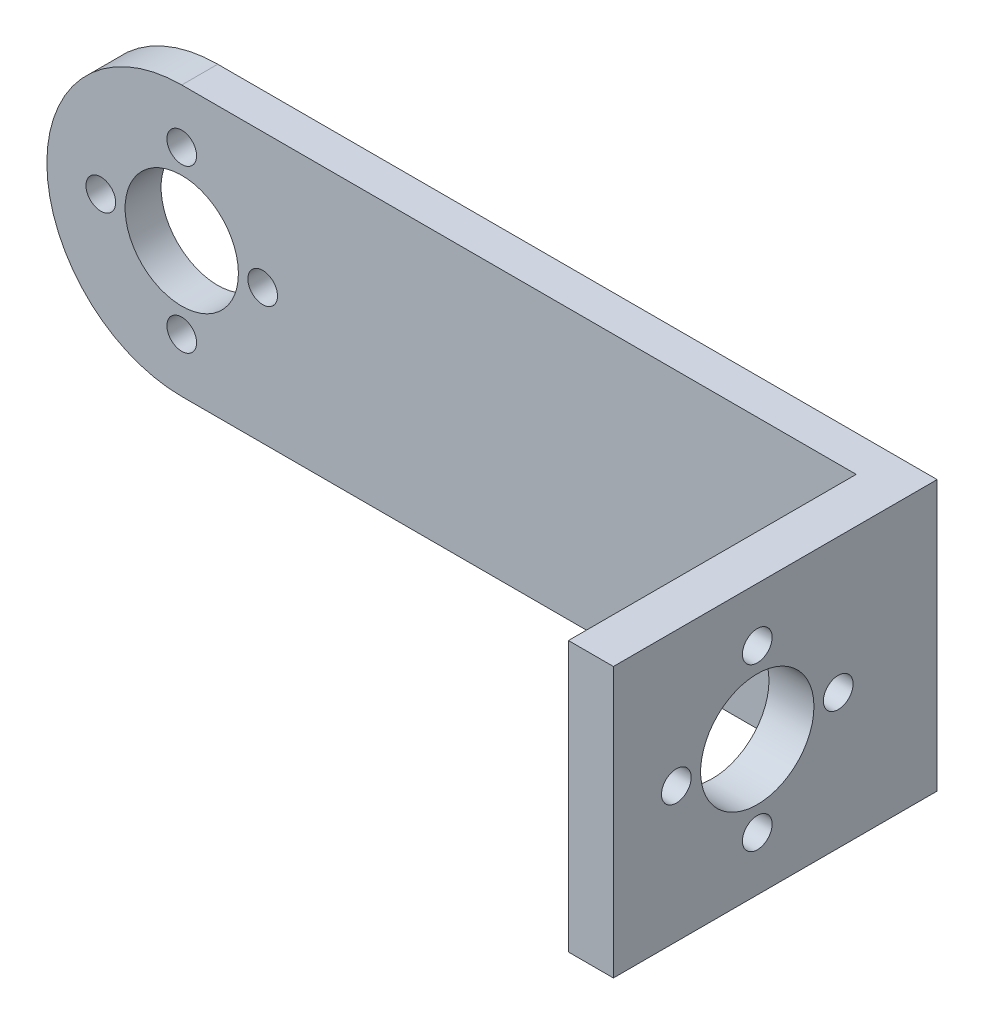
from build123d import *

# Parameters (mm, degrees)
EXTRUDE_1_DEPTH     = 4
SKETCH_2_W          = 5
SKETCH_2_H          = 30
EXTRUDE_2_DEPTH     = 36
SKETCH_4_R          = 6.3
SKETCH_4_R_2        = 1.65
CUT_EXTRUDE_1_DEPTH = 34


with BuildPart() as part:
    # 草图1 → 凸台-拉伸1 (new body)
    with BuildSketch(Plane.XY):
        with BuildLine():
            Line((0, 10.65), (0, 15))
            ThreePointArc((0, 15), (-15, 0), (0, -15))
            Line((0, -15), (0, -10.65))
            ThreePointArc((0, -10.65), (-1.219028814, -10.111966164), (-1.643053084, -8.84875))
            ThreePointArc((-1.643053084, -8.84875), (-6.363961031, -6.363961031), (-8.84875, -1.643053084))
            ThreePointArc((-8.84875, -1.643053084), (-10.65, 0), (-8.84875, 1.643053084))
            ThreePointArc((-8.84875, 1.643053084), (-6.363961031, 6.363961031), (-1.643053084, 8.84875))
            ThreePointArc((-1.643053084, 8.84875), (-1.219028814, 10.111966164), (0, 10.65))
        make_face()
        with BuildLine():
            ThreePointArc((0, 7.35), (-1.111966164, 7.780971186), (-1.643053084, 8.84875))
            ThreePointArc((-1.643053084, 8.84875), (-6.363961031, 6.363961031), (-8.84875, 1.643053084))
            ThreePointArc((-8.84875, 1.643053084), (-7.780971186, 1.111966164), (-7.35, 0))
            ThreePointArc((-7.35, 0), (-7.780971186, -1.111966164), (-8.84875, -1.643053084))
            ThreePointArc((-8.84875, -1.643053084), (-6.363961031, -6.363961031), (-1.643053084, -8.84875))
            ThreePointArc((-1.643053084, -8.84875), (-1.111966164, -7.780971186), (0, -7.35))
            Line((0, -7.35), (0, -6.3))
            ThreePointArc((0, -6.3), (-6.3, 0), (0, 6.3))
            Line((0, 6.3), (0, 7.35))
        make_face()
        with BuildLine():
            ThreePointArc((1.643053084, 8.84875), (1.111966164, 7.780971186), (0, 7.35))
            Line((0, 7.35), (0, 6.3))
            ThreePointArc((0, 6.3), (4.454772721, 4.454772721), (6.3, 0))
            ThreePointArc((6.3, 0), (4.454772721, -4.454772721), (0, -6.3))
            Line((0, -6.3), (0, -7.35))
            ThreePointArc((0, -7.35), (1.111966164, -7.780971186), (1.643053084, -8.84875))
            ThreePointArc((1.643053084, -8.84875), (6.363961031, -6.363961031), (8.84875, -1.643053084))
            ThreePointArc((8.84875, -1.643053084), (7.35, 0), (8.84875, 1.643053084))
            ThreePointArc((8.84875, 1.643053084), (6.363961031, 6.363961031), (1.643053084, 8.84875))
        make_face()
        with BuildLine():
            ThreePointArc((15, 0), (10.606601718, 10.606601718), (0, 15))
            Line((0, 15), (0, 10.65))
            ThreePointArc((0, 10.65), (1.166726189, 10.166726189), (1.65, 9))
            ThreePointArc((1.65, 9), (1.648262356, 8.924295274), (1.643053084, 8.84875))
            ThreePointArc((1.643053084, 8.84875), (6.363961031, 6.363961031), (8.84875, 1.643053084))
            ThreePointArc((8.84875, 1.643053084), (10.111966164, 1.219028814), (10.65, 0))
            ThreePointArc((10.65, 0), (10.111966164, -1.219028814), (8.84875, -1.643053084))
            ThreePointArc((8.84875, -1.643053084), (6.363961031, -6.363961031), (1.643053084, -8.84875))
            ThreePointArc((1.643053084, -8.84875), (1.648262356, -8.924295274), (1.65, -9))
            ThreePointArc((1.65, -9), (1.166726189, -10.166726189), (0, -10.65))
            Line((0, -10.65), (0, -15))
            ThreePointArc((0, -15), (10.606601718, -10.606601718), (15, 0))
        make_face()
        with BuildLine():
            Line((80, 15), (0, 15))
            ThreePointArc((0, 15), (10.606601718, 10.606601718), (15, 0))
            ThreePointArc((15, 0), (10.606601718, -10.606601718), (0, -15))
            Line((0, -15), (80, -15))
            Line((80, -15), (80, 15))
        make_face()
    extrude(amount=EXTRUDE_1_DEPTH)

    # 草图2 → 凸台-拉伸2 (add)
    with BuildSketch(Plane.XY):
        with Locations((77.5, 0)):
            Rectangle(SKETCH_2_W, SKETCH_2_H)
    extrude(amount=EXTRUDE_2_DEPTH)

    # 草图4 → 切除-拉伸1 (cut)
    with BuildSketch(Plane(origin=(80, 0, 0), x_dir=(0, 0, -1), z_dir=(1, 0, 0))):
        with Locations((-20, 0)):
            Circle(SKETCH_4_R)
        with Locations((-29, 0)):
            Circle(SKETCH_4_R_2)
        with Locations((-20, 9)):
            Circle(SKETCH_4_R_2)
        with Locations((-11, 0)):
            Circle(SKETCH_4_R_2)
        with Locations((-20, -9)):
            Circle(SKETCH_4_R_2)
    extrude(amount=-CUT_EXTRUDE_1_DEPTH, mode=Mode.SUBTRACT)


solid = part.part
